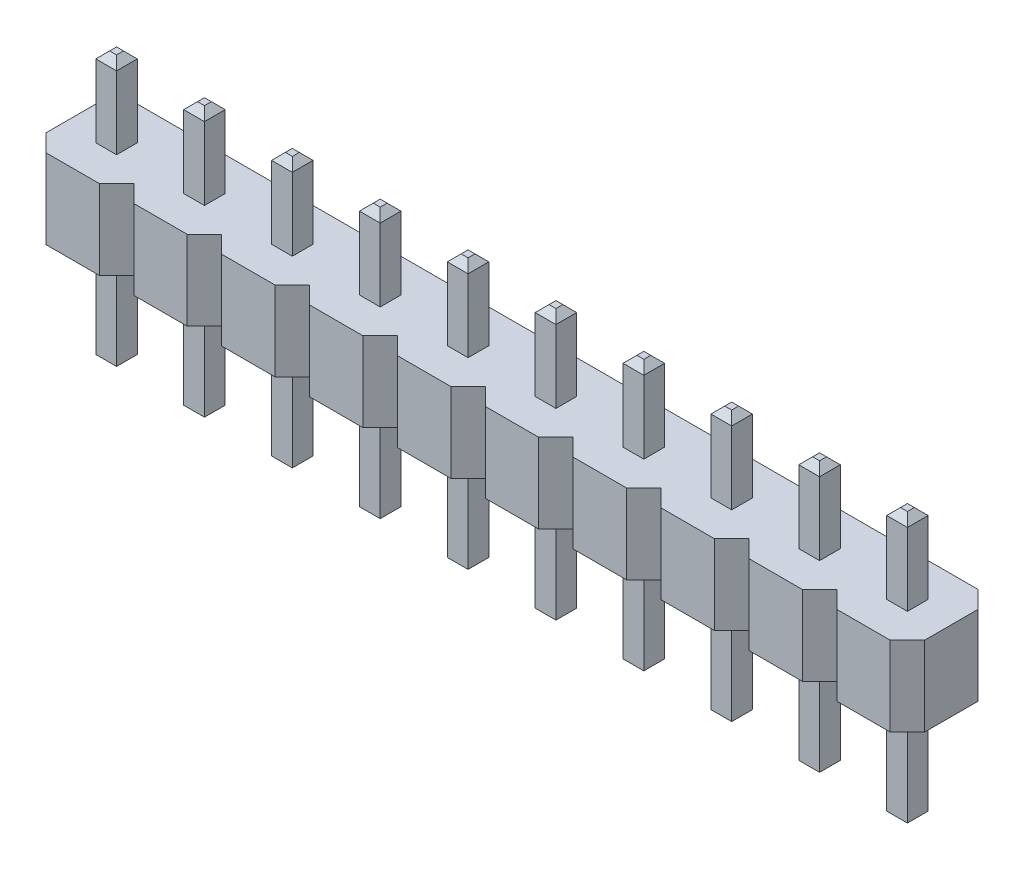
from build123d import *

# Parameters (mm, degrees)
BOSS_EXTRUDE1_DEPTH      = 2.3
BOSS_EXTRUDE2_DEPTH      = 2.3
BOSS_EXTRUDE2_DEPTH_BACK = 5.5
SKETCH3_W                = 0.6
SKETCH3_H                = 0.6
CHAMFER1_SIZE            = 0.2


with BuildPart() as part:
    # Sketch2 → Boss-Extrude1 (new body)
    with BuildSketch(Plane(origin=(0, 0, 0), x_dir=(1, 0, 0), z_dir=(0, 1, 0))):
        Polygon((-1.27, -0.77), (-1.27, 0.77), (-0.77, 1.27), (0.77, 1.27), (1.27, 0.77), (1.27, -0.77), (0.77, -1.27), (-0.77, -1.27), align=None)
        Polygon((3.31, 1.27), (3.81, 0.77), (3.81, -0.77), (3.31, -1.27), (1.77, -1.27), (1.27, -0.77), (1.27, 0.77), (1.77, 1.27), align=None)
        Polygon((5.85, 1.27), (6.35, 0.77), (6.35, -0.77), (5.85, -1.27), (4.31, -1.27), (3.81, -0.77), (3.81, 0.77), (4.31, 1.27), align=None)
        Polygon((8.39, 1.27), (8.89, 0.77), (8.89, -0.77), (8.39, -1.27), (6.85, -1.27), (6.35, -0.77), (6.35, 0.77), (6.85, 1.27), align=None)
        Polygon((10.93, 1.27), (11.43, 0.77), (11.43, -0.77), (10.93, -1.27), (9.39, -1.27), (8.89, -0.77), (8.89, 0.77), (9.39, 1.27), align=None)
        Polygon((13.47, 1.27), (13.97, 0.77), (13.97, -0.77), (13.47, -1.27), (11.93, -1.27), (11.43, -0.77), (11.43, 0.77), (11.93, 1.27), align=None)
        Polygon((16.01, 1.27), (16.51, 0.77), (16.51, -0.77), (16.01, -1.27), (14.47, -1.27), (13.97, -0.77), (13.97, 0.77), (14.47, 1.27), align=None)
        Polygon((18.55, 1.27), (19.05, 0.77), (19.05, -0.77), (18.55, -1.27), (17.01, -1.27), (16.51, -0.77), (16.51, 0.77), (17.01, 1.27), align=None)
        Polygon((21.09, 1.27), (21.59, 0.77), (21.59, -0.77), (21.09, -1.27), (19.55, -1.27), (19.05, -0.77), (19.05, 0.77), (19.55, 1.27), align=None)
        Polygon((23.63, 1.27), (24.13, 0.77), (24.13, -0.77), (23.63, -1.27), (22.09, -1.27), (21.59, -0.77), (21.59, 0.77), (22.09, 1.27), align=None)
    extrude(amount=BOSS_EXTRUDE1_DEPTH)

    # Sketch3 → Boss-Extrude2 (add, two sides: drawn at the far end of the back side and taken through both)
    with BuildSketch(Plane(origin=(0, 2.3, 0), x_dir=(1, 0, 0), z_dir=(0, 1, 0)).offset(-BOSS_EXTRUDE2_DEPTH_BACK)):
        Rectangle(SKETCH3_W, SKETCH3_H)
        with Locations((2.54, 0)):
            Rectangle(SKETCH3_W, SKETCH3_H)
        with Locations((5.08, 0)):
            Rectangle(SKETCH3_W, SKETCH3_H)
        with Locations((7.62, 0)):
            Rectangle(SKETCH3_W, SKETCH3_H)
        with Locations((10.16, 0)):
            Rectangle(SKETCH3_W, SKETCH3_H)
        with Locations((12.7, 0)):
            Rectangle(SKETCH3_W, SKETCH3_H)
        with Locations((15.24, 0)):
            Rectangle(SKETCH3_W, SKETCH3_H)
        with Locations((17.78, 0)):
            Rectangle(SKETCH3_W, SKETCH3_H)
        with Locations((20.32, 0)):
            Rectangle(SKETCH3_W, SKETCH3_H)
        with Locations((22.86, 0)):
            Rectangle(SKETCH3_W, SKETCH3_H)
    extrude(amount=BOSS_EXTRUDE2_DEPTH + BOSS_EXTRUDE2_DEPTH_BACK)

    # Chamfer1
    chamfer1_edges = [part.edges().sort_by_distance(p)[0] for p in [
        (0, -3.2, 0.3),
        (0.3, -3.2, 0),
        (-0.3, 4.6, 0),
        (0, 4.6, -0.3),
        (-0.3, -3.2, 0),
        (0, -3.2, -0.3),
        (0, 4.6, 0.3),
        (0.3, 4.6, 0),
        (2.84, -3.2, 0),
        (2.54, -3.2, 0.3),
        (2.24, 4.6, 0),
        (2.54, 4.6, -0.3),
        (2.24, -3.2, 0),
        (2.54, -3.2, -0.3),
        (2.54, 4.6, 0.3),
        (2.84, 4.6, 0),
        (5.38, -3.2, 0),
        (5.08, -3.2, 0.3),
        (4.78, 4.6, 0),
        (5.08, 4.6, -0.3),
        (4.78, -3.2, 0),
        (5.08, -3.2, -0.3),
        (5.08, 4.6, 0.3),
        (5.38, 4.6, 0),
        (7.92, -3.2, 0),
        (7.62, -3.2, 0.3),
        (7.32, 4.6, 0),
        (7.62, 4.6, -0.3),
        (7.32, -3.2, 0),
        (7.62, -3.2, -0.3),
        (7.62, 4.6, 0.3),
        (7.92, 4.6, 0),
        (10.46, -3.2, 0),
        (10.16, -3.2, 0.3),
        (9.86, 4.6, 0),
        (10.16, 4.6, -0.3),
        (9.86, -3.2, 0),
        (10.16, -3.2, -0.3),
        (10.16, 4.6, 0.3),
        (10.46, 4.6, 0),
        (13, -3.2, 0),
        (12.7, -3.2, 0.3),
        (12.4, 4.6, 0),
        (12.7, 4.6, -0.3),
        (12.4, -3.2, 0),
        (12.7, -3.2, -0.3),
        (12.7, 4.6, 0.3),
        (13, 4.6, 0),
        (15.54, -3.2, 0),
        (15.24, -3.2, 0.3),
        (14.94, 4.6, 0),
        (15.24, 4.6, -0.3),
        (14.94, -3.2, 0),
        (15.24, -3.2, -0.3),
        (15.24, 4.6, 0.3),
        (15.54, 4.6, 0),
        (18.08, -3.2, 0),
        (17.78, -3.2, 0.3),
        (17.48, 4.6, 0),
        (17.78, 4.6, -0.3),
        (17.48, -3.2, 0),
        (17.78, -3.2, -0.3),
        (17.78, 4.6, 0.3),
        (18.08, 4.6, 0),
        (20.62, -3.2, 0),
        (20.32, -3.2, 0.3),
        (20.02, 4.6, 0),
        (20.32, 4.6, -0.3),
        (20.02, -3.2, 0),
        (20.32, -3.2, -0.3),
        (20.32, 4.6, 0.3),
        (20.62, 4.6, 0),
        (23.16, -3.2, 0),
        (22.86, -3.2, 0.3),
        (22.56, 4.6, 0),
        (22.86, 4.6, -0.3),
        (22.56, -3.2, 0),
        (22.86, -3.2, -0.3),
        (22.86, 4.6, 0.3),
        (23.16, 4.6, 0),
    ]]
    chamfer(chamfer1_edges, length=CHAMFER1_SIZE)


solid = part.part
